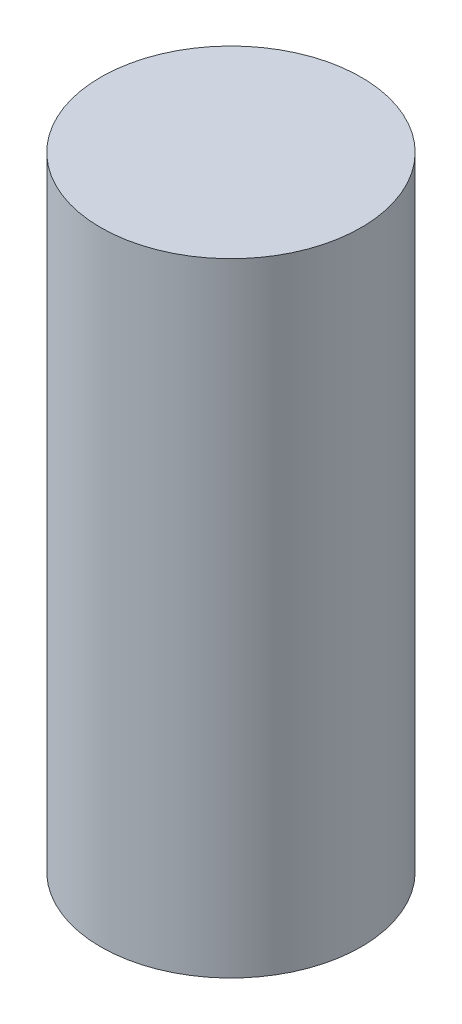
from build123d import *

# Parameters (mm, degrees)
SKETCH1_R           = 3
BOSS_EXTRUDE1_DEPTH = 14.346


with BuildPart() as part:
    # Sketch1 → Boss-Extrude1 (new body)
    with BuildSketch(Plane(origin=(0, 0, 0), x_dir=(1, 0, 0), z_dir=(0, 1, 0))):
        with Locations(Location((0, 0, 0), (0, 0, 270))):
            Circle(SKETCH1_R)
    extrude(amount=BOSS_EXTRUDE1_DEPTH)


solid = part.part
